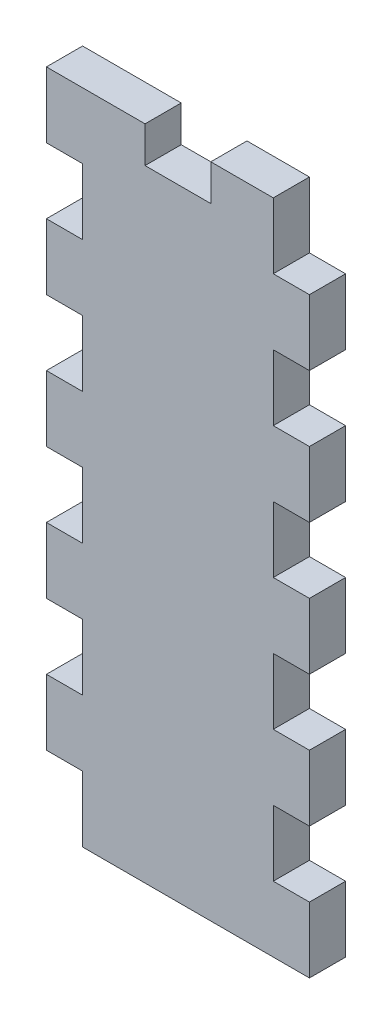
from build123d import *

# Parameters (mm, degrees)
SKETCH_1_W          = 40
SKETCH_1_H          = 100
EXTRUDE_1_DEPTH     = 5.5
SKETCH_2_W          = 5.5
SKETCH_2_H          = 10
CUT_EXTRUDE_1_DEPTH = 55.13178364
SKETCH_3_W          = 10
SKETCH_3_H          = 5.5
CUT_EXTRUDE_2_DEPTH = 55.13178364


with BuildPart() as part:
    # ｽｹｯﾁ1 → ﾎﾞｽ - 押し出し1 (new body)
    with BuildSketch(Plane.XY):
        Rectangle(SKETCH_1_W, SKETCH_1_H)
    extrude(amount=EXTRUDE_1_DEPTH)

    # ｽｹｯﾁ2 → ｶｯﾄ - 押し出し1 (cut, through all)
    with BuildSketch(Plane.XY.offset(5.5)):
        with Locations((-17.25, -45)):
            Rectangle(SKETCH_2_W, SKETCH_2_H)
        with Locations((17.25, -35)):
            Rectangle(SKETCH_2_W, SKETCH_2_H)
        with Locations((-17.25, -25)):
            Rectangle(SKETCH_2_W, SKETCH_2_H)
        with Locations((17.25, -15)):
            Rectangle(SKETCH_2_W, SKETCH_2_H)
        with Locations((-17.25, -5)):
            Rectangle(SKETCH_2_W, SKETCH_2_H)
        with Locations((17.25, 5)):
            Rectangle(SKETCH_2_W, SKETCH_2_H)
        with Locations((-17.25, 15)):
            Rectangle(SKETCH_2_W, SKETCH_2_H)
        with Locations((17.25, 25)):
            Rectangle(SKETCH_2_W, SKETCH_2_H)
        with Locations((-17.25, 35)):
            Rectangle(SKETCH_2_W, SKETCH_2_H)
        with Locations((17.25, 45)):
            Rectangle(SKETCH_2_W, SKETCH_2_H)
    extrude(amount=-CUT_EXTRUDE_1_DEPTH, mode=Mode.SUBTRACT)

    # ｽｹｯﾁ3 → ｶｯﾄ - 押し出し2 (cut, through all)
    with BuildSketch(Plane.XY.offset(5.5)):
        with Locations((0, 47.25)):
            Rectangle(SKETCH_3_W, SKETCH_3_H)
    extrude(amount=-CUT_EXTRUDE_2_DEPTH, mode=Mode.SUBTRACT)


solid = part.part
